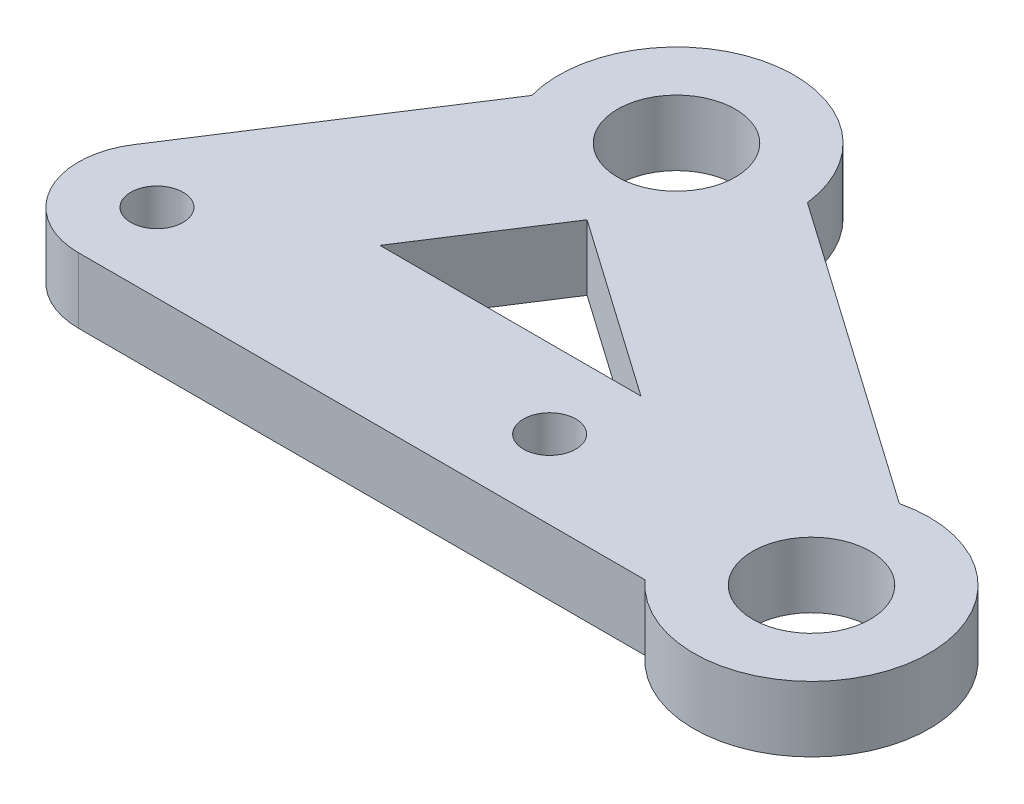
from build123d import *

# Parameters (mm, degrees)
SKETCH_1_R      = 2
SKETCH_1_R_2    = 4.5
EXTRUDE_1_DEPTH = 5


with BuildPart() as part:
    # 草图1 → 凸台-拉伸1 (new body)
    with BuildSketch(Plane(origin=(0, 0, 0), x_dir=(1, 0, 0), z_dir=(0, 1, 0))):
        with BuildLine():
            Line((-4.067495668, 16.82077086), (19.347989798, 0.425071426))
            ThreePointArc((19.347989798, 0.425071426), (29.985022701, -11.043860741), (14.693366212, -14.337508546))
            Line((14.693366212, -14.337508546), (-28.601114149, -14.337508546))
            ThreePointArc((-28.601114149, -14.337508546), (-33.872016823, -11.20414159), (-33.637695408, -5.076703549))
            Line((-33.637695408, -5.076703549), (-21.686265326, 13.383262263))
            ThreePointArc((-21.686265326, 13.383262263), (-14.727441536, 24.58696991), (-4.067495668, 16.82077086))
        make_face()
        with Locations(Location((1.398885851, -8.337508546, 0), (0, 0, 270))):
            Circle(SKETCH_1_R, mode=Mode.SUBTRACT)
        with Locations(Location((21.401570144, -8.337508546, 0), (0, 0, 270))):
            Circle(SKETCH_1_R_2, mode=Mode.SUBTRACT)
        with Locations(Location((-28.601114149, -8.337508546, 0), (0, 0, 270))):
            Circle(SKETCH_1_R, mode=Mode.SUBTRACT)
        with Locations(Location((-13.003993251, 15.7535263, 0), (0, 0, 270))):
            Circle(SKETCH_1_R_2, mode=Mode.SUBTRACT)
        Polygon((-11.348795412, 7.269896763), (2.37200133, -2.337508546), (-17.56886288, -2.337508546), align=None, mode=Mode.SUBTRACT)
    extrude(amount=EXTRUDE_1_DEPTH)


solid = part.part
